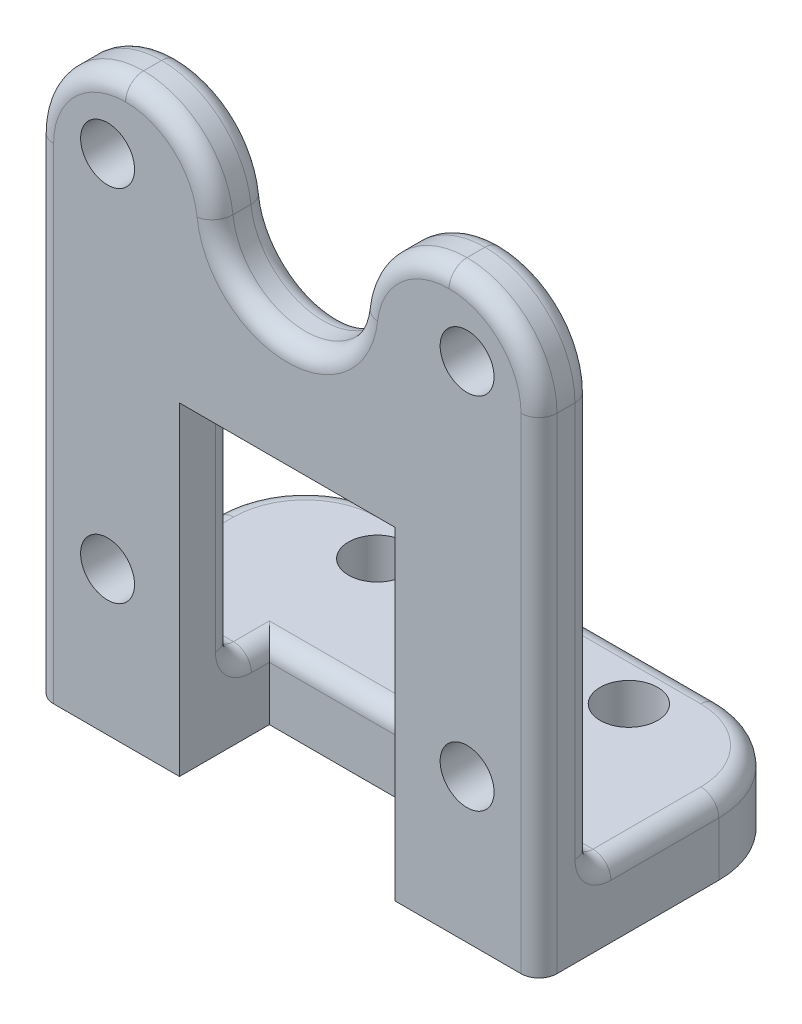
from build123d import *

# Parameters (mm, degrees)
SKETCH_1_R          = 1.5
EXTRUDE_2_DEPTH     = 3
EXTRUDE_3_DEPTH     = 4
SKETCH_3_R          = 1.6
CUT_EXTRUDE_1_DEPTH = 5
FILLET_1_R          = 5
FILLET_2_R          = 1
FILLET_3_R          = 1


with BuildPart() as part:
    # 草图1 → 凸台-拉伸2 (new body)
    with BuildSketch(Plane.XY):
        with BuildLine():
            Line((6, -14), (14, -14))
            Line((14, -14), (14, 14))
            Line((14, 14), (0.634428877, 14))
            ThreePointArc((0.634428877, 14), (0, 5.95), (-0.634428877, 14))
            Line((-0.634428877, 14), (-14, 14))
            Line((-14, 14), (-14, -14))
            Line((-14, -14), (-6, -14))
            Line((-6, -14), (-6, 0))
            Line((-6, 0), (6, 0))
            Line((6, 0), (6, -14))
        make_face()
        with Locations((-10, 10)):
            Circle(SKETCH_1_R, mode=Mode.SUBTRACT)
        with Locations((10, 10)):
            Circle(SKETCH_1_R, mode=Mode.SUBTRACT)
        with Locations((10, -10)):
            Circle(SKETCH_1_R, mode=Mode.SUBTRACT)
        with Locations((-10, -10)):
            Circle(SKETCH_1_R, mode=Mode.SUBTRACT)
    extrude(amount=EXTRUDE_2_DEPTH)

    # 草图2 → 凸台-拉伸3 (add)
    with BuildSketch(Plane.XZ.offset(14)):
        Polygon((6, 3), (14, 3), (14, -12), (-14, -12), (-14, 3), (-6, 3), (-6, -2), (6, -2), align=None)
    extrude(amount=EXTRUDE_3_DEPTH)

    # 草图3 → 切除-拉伸1 (cut)
    with BuildSketch(Plane(origin=(0, -14, 0), x_dir=(1, 0, 0), z_dir=(0, 1, 0))):
        with Locations(Location((-7, 9, 0), (0, 0, 270))):
            Circle(SKETCH_3_R)
        with Locations(Location((7, 9, 0), (0, 0, 90))):
            Circle(SKETCH_3_R)
    extrude(amount=-CUT_EXTRUDE_1_DEPTH, mode=Mode.SUBTRACT)

    # 圆角1
    fillet_1_edges = [part.edges().sort_by_distance(p)[0] for p in [
        (-14, 14, 1.5),
        (-0.634428877, 14, 1.5),
        (0.634428877, 14, 1.5),
        (14, 14, 1.5),
        (-14, -16, -12),
        (14, -16, -12),
    ]]
    fillet(fillet_1_edges, radius=FILLET_1_R)

    # 圆角2
    fillet_2_edges = [part.edges().sort_by_distance(p)[0] for p in [
        (0, 0, 0),
        (-6, -7, 0),
        (-10, -14, 0),
        (14, -2.5, 0),
        (-14, -14, -3.5),
        (6, -14, -1),
        (0, -14, -2),
        (-6, -14, -1),
        (-8.997290851, 14, 0),
        (-14, -2.5, 0),
        (0, 5.95, 0),
        (8.997290851, 14, 0),
        (12.535533906, 12.535533906, 0),
        (-12.535533906, 12.535533906, 0),
        (5.660097555, 12.725750323, 0),
        (-5.660097555, 12.725750323, 0),
        (10, -14, 0),
        (14, -14, -3.5),
        (0, -14, -12),
        (6, -7, 0),
        (12.535533906, -14, -10.535533906),
        (-12.535533906, -14, -10.535533906),
    ]]
    fillet(fillet_2_edges, radius=FILLET_2_R)

    # 圆角3
    fillet_3_edges = [part.edges().sort_by_distance(p)[0] for p in [
        (14, -4.5, 3),
        (-8.997290851, 14, 3),
        (0, 5.95, 3),
        (8.997290851, 14, 3),
        (-14, -4.5, 3),
        (12.535533906, 12.535533906, 3),
        (-12.535533906, 12.535533906, 3),
        (5.660097555, 12.725750323, 3),
        (-5.660097555, 12.725750323, 3),
    ]]
    fillet(fillet_3_edges, radius=FILLET_3_R)


solid = part.part
